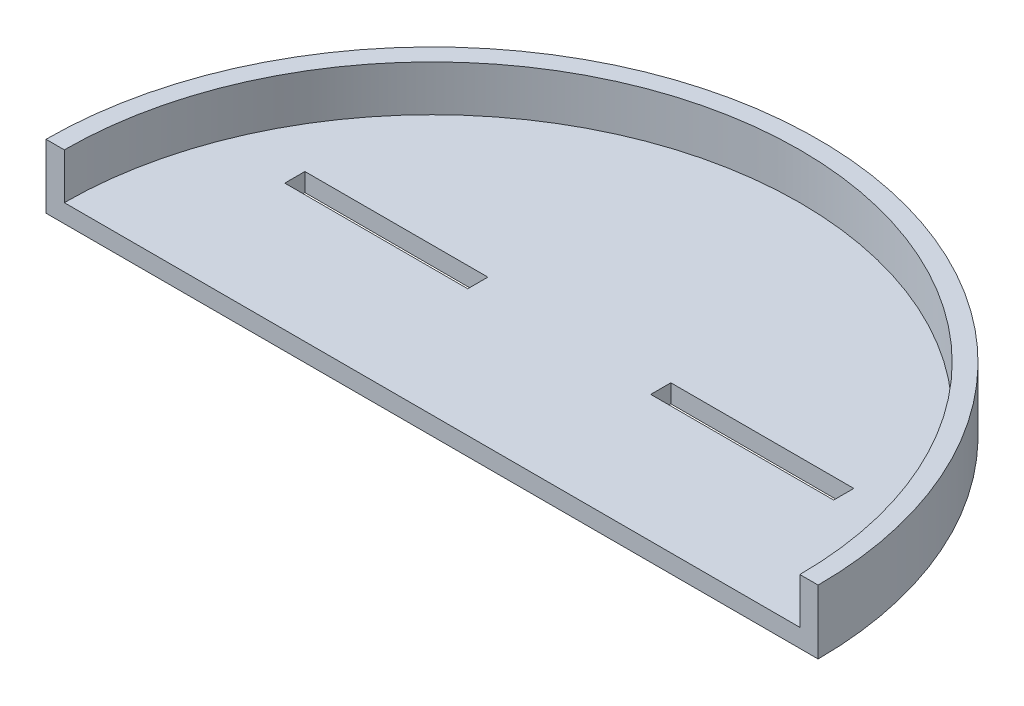
from build123d import *

# Parameters (mm, degrees)
SKETCH1_R           = 53.594
SKETCH1_R_2         = 51.054
BOSS_EXTRUDE2_DEPTH = 6.35
BOSS_EXTRUDE3_START = 2.54
SKETCH2_R           = 53.594
BOSS_EXTRUDE3_DEPTH = 2.54
SKETCH4_W           = 25.4
SKETCH4_H           = 2.794
CUT_EXTRUDE1_DEPTH  = 77.058899361
CUT_EXTRUDE2_DEPTH  = 77.312946294


with BuildPart() as part:
    # Sketch1 → Boss-Extrude2 (new body)
    with BuildSketch(Plane(origin=(0, 0, 0), x_dir=(1, 0, 0), z_dir=(0, 1, 0))):
        with Locations(Location((0, 0, 0), (0, 0, 270))):
            Circle(SKETCH1_R)
        with Locations(Location((0, 0, 0), (0, 0, 270))):
            Circle(SKETCH1_R_2, mode=Mode.SUBTRACT)
    extrude(amount=BOSS_EXTRUDE2_DEPTH)

    # Sketch2 → Boss-Extrude3 (add)
    with BuildSketch(Plane.XZ.offset(BOSS_EXTRUDE3_START)):
        with Locations(Location((0, 0, 0), (0, 0, 270))):
            Circle(SKETCH2_R)
    extrude(amount=-BOSS_EXTRUDE3_DEPTH)

    # Sketch4 → Cut-Extrude1 (cut, through all)
    with BuildSketch(Plane(origin=(0, 0, 0), x_dir=(1, 0, 0), z_dir=(0, 1, 0))):
        with Locations((-25.4, 19.05)):
            Rectangle(SKETCH4_W, SKETCH4_H)
        with Locations((25.4, 19.05)):
            Rectangle(SKETCH4_W, SKETCH4_H)
    extrude(amount=-CUT_EXTRUDE1_DEPTH, mode=Mode.SUBTRACT)

    # Sketch5 → Cut-Extrude2 (cut, through all)
    with BuildSketch(Plane.XZ.offset(2.54)):
        Polygon((-349.002283825, 0), (-69.85, 0), (69.85, 0), (349.002283825, 0), (349.002283825, 558.304567649), (-349.002283825, 558.304567649), align=None)
    extrude(amount=-CUT_EXTRUDE2_DEPTH, mode=Mode.SUBTRACT)


solid = part.part
